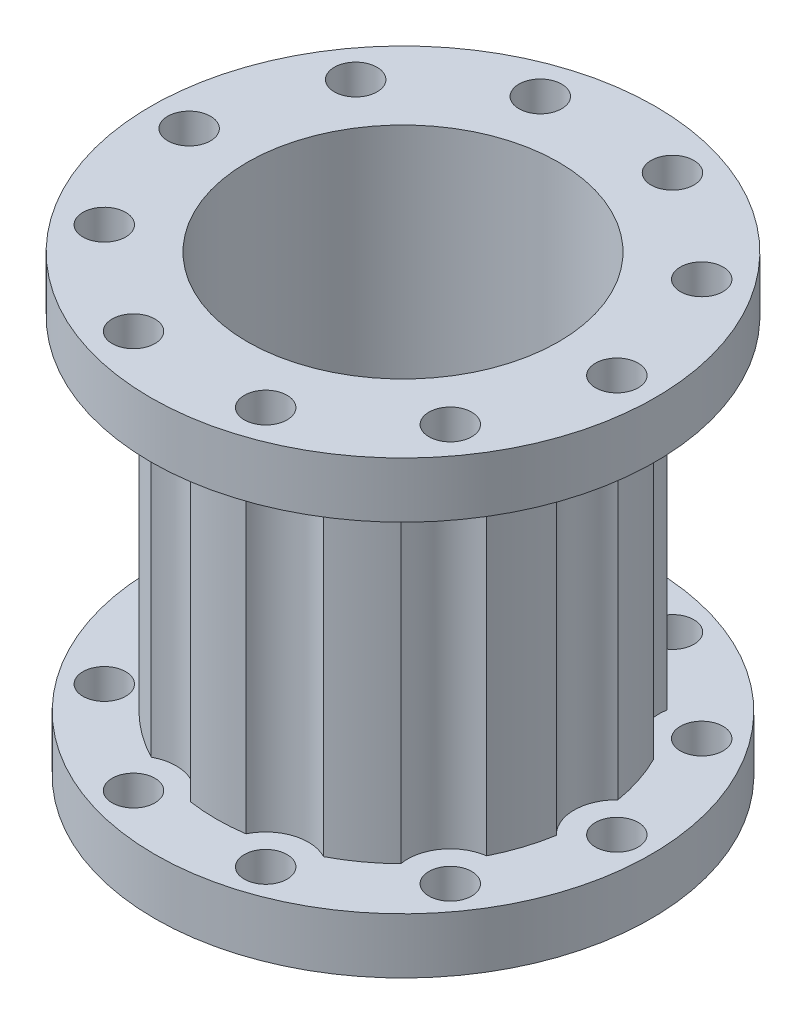
from build123d import *

# Parameters (mm, degrees)
SKETCH2_R           = 21.825
SKETCH2_R_2         = 18.19
BOSS_EXTRUDE1_DEPTH = 40
SKETCH4_R           = 29.5
SKETCH4_R_2         = 18.19
BOSS_EXTRUDE3_DEPTH = 6.5
BOSS_EXTRUDE4_START = 6.5
SKETCH5_R           = 29
SKETCH5_R_2         = 18.19
BOSS_EXTRUDE4_DEPTH = 6.5
FILLET1_R           = 2
HOLE1_D             = 5
CIRPATTERN1_COUNT   = 10
SKETCH9_R           = 5
CUT_EXTRUDE1_DEPTH  = 40
CIRPATTERN2_COUNT   = 10


with BuildPart() as part:
    # Sketch2 → Boss-Extrude1 (new body)
    with BuildSketch(Plane(origin=(0, 0, 0), x_dir=(1, 0, 0), z_dir=(0, 1, 0))):
        with Locations(Location((0, 0, 0), (0, 0, 270))):
            Circle(SKETCH2_R)
        with Locations(Location((0, 0, 0), (0, 0, 270))):
            Circle(SKETCH2_R_2, mode=Mode.SUBTRACT)
    extrude(amount=BOSS_EXTRUDE1_DEPTH)

    # Sketch4 → Boss-Extrude3 (add)
    with BuildSketch(Plane(origin=(0, 40, 0), x_dir=(1, 0, 0), z_dir=(0, 1, 0))):
        with Locations(Location((0, 0, 0), (0, 0, 90))):
            Circle(SKETCH4_R)
        with Locations(Location((0, 0, 0), (0, 0, 270))):
            Circle(SKETCH4_R_2, mode=Mode.SUBTRACT)
    extrude(amount=BOSS_EXTRUDE3_DEPTH)

    # Sketch5 → Boss-Extrude4 (add)
    with BuildSketch(Plane.XZ.offset(BOSS_EXTRUDE4_START)):
        with Locations(Location((0, 0, 0), (0, 0, 90))):
            Circle(SKETCH5_R)
        with Locations(Location((0, 0, 0), (0, 0, 270))):
            Circle(SKETCH5_R_2, mode=Mode.SUBTRACT)
    extrude(amount=-BOSS_EXTRUDE4_DEPTH)

    # Fillet1
    fillet1_edges = [part.edges().sort_by_distance(p)[0] for p in [
        (0, 40, -21.825),
    ]]
    fillet(fillet1_edges, radius=FILLET1_R)

    # Hole1 (through all)
    with Locations(Plane(origin=(0, -6.5, 0), x_dir=(-1, 0, 0), z_dir=(0, -1, 0))):
        with Locations((25, 0)):
            hole1 = Hole(HOLE1_D / 2)

    # CirPattern1: Hole1 ×10 about axis
    cirpattern1_axis = Axis((0, 0, 0), (0, 1, 0))
    for i in range(1, CIRPATTERN1_COUNT):
        add(hole1.rotate(cirpattern1_axis, i * 360 / CIRPATTERN1_COUNT), mode=Mode.SUBTRACT)

    # Sketch9 → Cut-Extrude1 (cut)
    with BuildSketch(Plane.XZ.offset(-40)):
        with Locations((-20.225424859, 14.694631307)):
            Circle(SKETCH9_R)
    cut_extrude1 = extrude(amount=CUT_EXTRUDE1_DEPTH, mode=Mode.SUBTRACT)

    # CirPattern2: Cut-Extrude1 ×10 about axis
    cirpattern2_axis = Axis((0, 0, 0), (0, 1, 0))
    for i in range(1, CIRPATTERN2_COUNT):
        add(cut_extrude1.rotate(cirpattern2_axis, i * 360 / CIRPATTERN2_COUNT), mode=Mode.SUBTRACT)


solid = part.part
